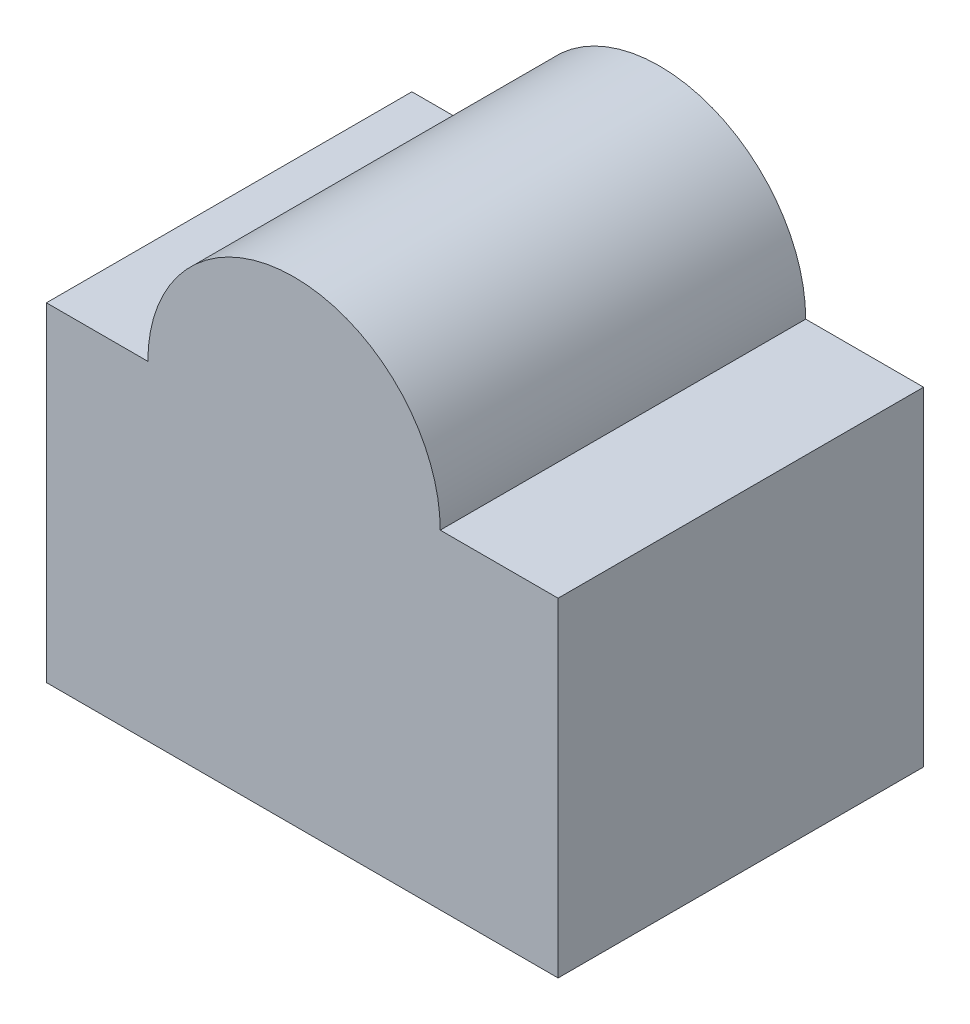
from build123d import *

# Parameters (mm, degrees)
BOSS_EXTRU_1_DEPTH = 500


with BuildPart() as part:
    # Esquisse1 → Boss.-Extru.1 (new body)
    with BuildSketch(Plane.XY):
        with BuildLine():
            Line((0, 0), (700, 0))
            Line((700, 0), (700, 450))
            Line((700, 450), (538.758062097, 450))
            ThreePointArc((538.758062097, 450), (338.758062097, 650), (138.758062097, 450))
            Line((138.758062097, 450), (0, 450))
            Line((0, 450), (0, 0))
        make_face()
    extrude(amount=BOSS_EXTRU_1_DEPTH)


solid = part.part
